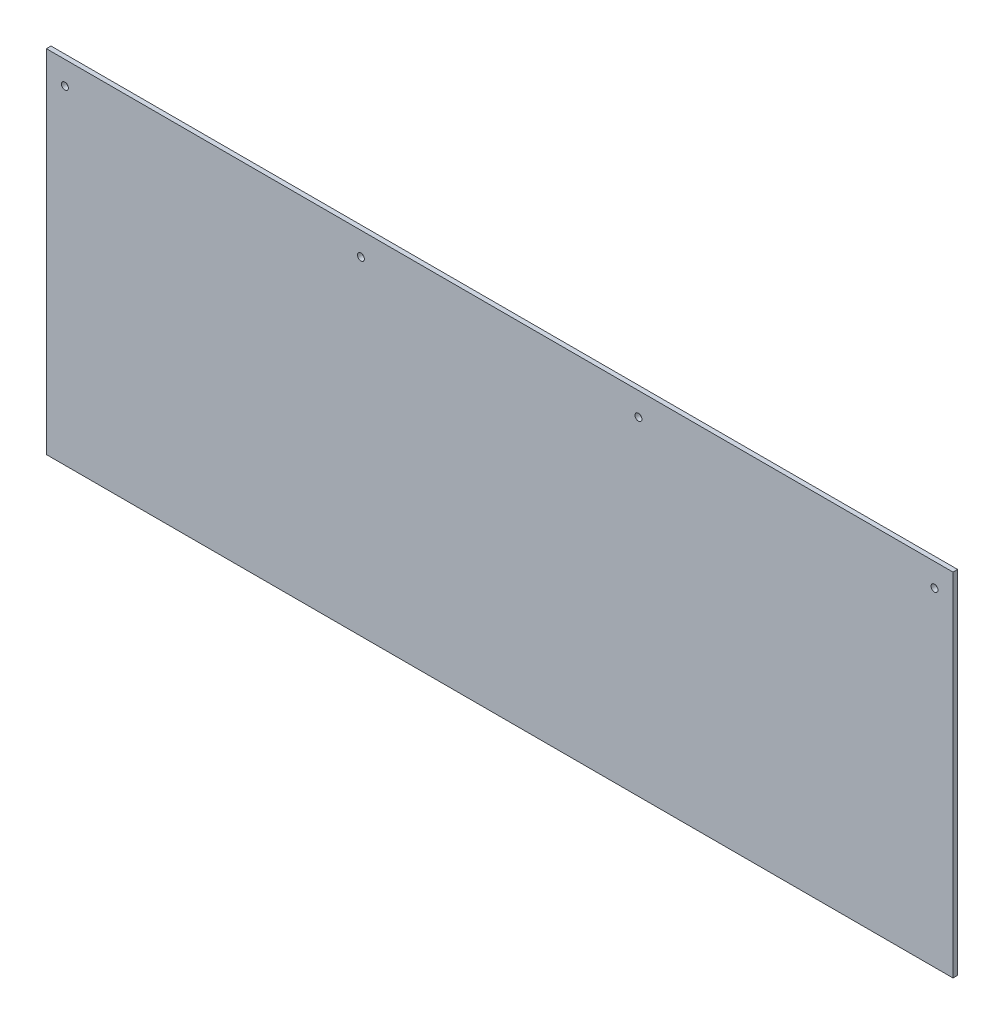
from build123d import *

# Parameters (mm, degrees)
SKETCH1_W           = 1244.6
SKETCH1_H           = 482.6
BOSS_EXTRUDE1_DEPTH = 6.35
SKETCH2_R           = 4.7625
CUT_EXTRUDE1_DEPTH  = 1335.905330913


with BuildPart() as part:
    # Sketch1 → Boss-Extrude1 (new body)
    with BuildSketch(Plane.XY):
        with Locations((622.3, 241.3)):
            Rectangle(SKETCH1_W, SKETCH1_H)
    extrude(amount=BOSS_EXTRUDE1_DEPTH)

    # Sketch2 → Cut-Extrude1 (cut, through all)
    with BuildSketch(Plane.XY.offset(6.35)):
        with Locations((25.4, 450.85)):
            Circle(SKETCH2_R)
        with Locations((431.8, 450.85)):
            Circle(SKETCH2_R)
        with Locations((812.8, 450.85)):
            Circle(SKETCH2_R)
        with Locations((1219.2, 450.85)):
            Circle(SKETCH2_R)
    extrude(amount=-CUT_EXTRUDE1_DEPTH, mode=Mode.SUBTRACT)


solid = part.part
